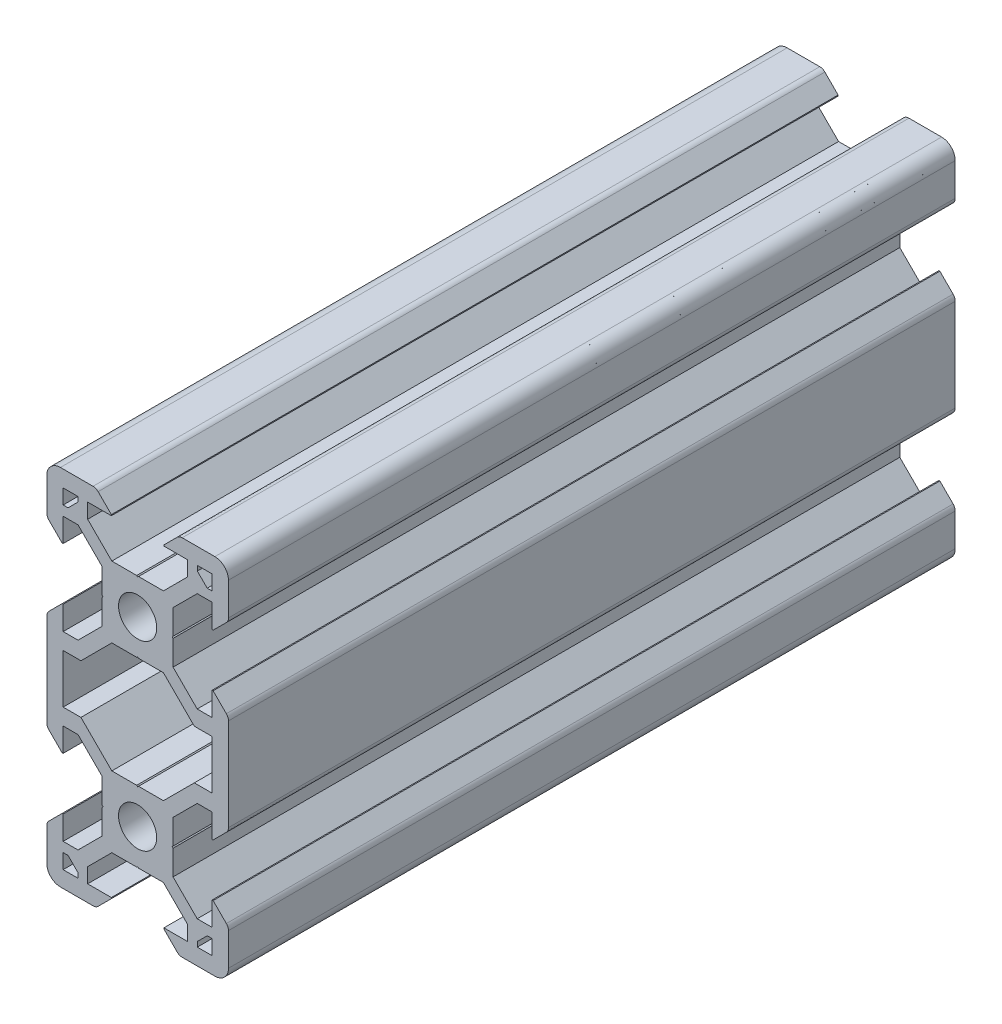
from build123d import *

# Parameters (mm, degrees)
SKETCH2_R           = 2.1
BOSS_EXTRUDE1_DEPTH = 80


with BuildPart() as part:
    # Sketch2 → Boss-Extrude1 (new body)
    with BuildSketch(Plane.XY):
        with BuildLine():
            Line((-0.1, 3.9), (0, 3.8))
            Line((0, 3.8), (0.1, 3.9))
            Line((0.1, 3.9), (2.840365134, 3.9))
            Line((2.840365134, 3.9), (5.5, 6.558825842))
            Line((5.5, 6.558825842), (5.5, 8.197505675))
            Line((5.5, 8.197505675), (2.89, 8.197505675))
            Line((2.89, 8.197505675), (2.89, 8.307505675))
            Line((2.89, 8.307505675), (4.348614357, 9.766120032))
            ThreePointArc((4.348614357, 9.766120032), (4.604908803, 9.937370505), (4.907228714, 9.997505675))
            Line((4.907228714, 9.997505675), (8.5, 9.997505675))
            ThreePointArc((8.5, 9.997505675), (9.560660172, 9.558165846), (10, 8.497505675))
            Line((10, 8.497505675), (10, 4.904734389))
            ThreePointArc((10, 4.904734389), (9.939864831, 4.602414477), (9.768614357, 4.346120032))
            Line((9.768614357, 4.346120032), (8.31, 2.887505675))
            Line((8.31, 2.887505675), (8.2, 2.887505675))
            Line((8.2, 2.887505675), (8.2, 5.497505675))
            Line((8.2, 5.497505675), (6.56, 5.497505675))
            Line((6.56, 5.497505675), (3.9, 2.83831481))
            Line((3.9, 2.83831481), (3.9, 0.1))
            Line((3.9, 0.1), (3.8, 0))
            Line((3.8, 0), (3.9, -0.1))
            Line((3.9, -0.1), (3.9, -2.84))
            Line((3.9, -2.84), (6.56, -5.5))
            Line((6.56, -5.5), (8.2, -5.5))
            Line((8.2, -5.5), (8.2, -2.89))
            Line((8.2, -2.89), (8.31, -2.89))
            Line((8.31, -2.89), (9.765685425, -4.345685425))
            ThreePointArc((9.765685425, -4.345685425), (9.939103626, -4.605224104), (10, -4.91137085))
            Line((10, -4.91137085), (10, -15.08862915))
            ThreePointArc((10, -15.08862915), (9.939103626, -15.394775896), (9.765685425, -15.654314575))
            Line((9.765685425, -15.654314575), (8.31, -17.11))
            Line((8.31, -17.11), (8.2, -17.11))
            Line((8.2, -17.11), (8.2, -14.5))
            Line((8.2, -14.5), (6.56, -14.5))
            Line((6.56, -14.5), (3.9, -17.16))
            Line((3.9, -17.16), (3.9, -19.9))
            Line((3.9, -19.9), (3.8, -20))
            Line((3.8, -20), (3.9, -20.1))
            Line((3.9, -20.1), (3.9, -22.83831481))
            Line((3.9, -22.83831481), (6.56, -25.497505675))
            Line((6.56, -25.497505675), (8.2, -25.497505675))
            Line((8.2, -25.497505675), (8.2, -22.887505675))
            Line((8.2, -22.887505675), (8.31, -22.887505675))
            Line((8.31, -22.887505675), (9.768614357, -24.346120032))
            ThreePointArc((9.768614357, -24.346120032), (9.939864831, -24.602414477), (10, -24.904734389))
            Line((10, -24.904734389), (10, -28.497505675))
            ThreePointArc((10, -28.497505675), (9.560660172, -29.558165846), (8.5, -29.997505675))
            Line((8.5, -29.997505675), (4.907228714, -29.997505675))
            ThreePointArc((4.907228714, -29.997505675), (4.604908803, -29.937370505), (4.348614357, -29.766120032))
            Line((4.348614357, -29.766120032), (2.89, -28.307505675))
            Line((2.89, -28.307505675), (2.89, -28.197505675))
            Line((2.89, -28.197505675), (5.5, -28.197505675))
            Line((5.5, -28.197505675), (5.5, -26.558825842))
            Line((5.5, -26.558825842), (2.840365134, -23.9))
            Line((2.840365134, -23.9), (0.1, -23.9))
            Line((0.1, -23.9), (0, -23.8))
            Line((0, -23.8), (-0.1, -23.9))
            Line((-0.1, -23.9), (-2.840365134, -23.9))
            Line((-2.840365134, -23.9), (-5.5, -26.558825842))
            Line((-5.5, -26.558825842), (-5.5, -28.197505675))
            Line((-5.5, -28.197505675), (-2.89, -28.197505675))
            Line((-2.89, -28.197505675), (-2.89, -28.307505675))
            Line((-2.89, -28.307505675), (-4.348614357, -29.766120032))
            ThreePointArc((-4.348614357, -29.766120032), (-4.604908803, -29.937370505), (-4.907228714, -29.997505675))
            Line((-4.907228714, -29.997505675), (-8.5, -29.997505675))
            ThreePointArc((-8.5, -29.997505675), (-9.560660172, -29.558165846), (-10, -28.497505675))
            Line((-10, -28.497505675), (-10, -24.904734389))
            ThreePointArc((-10, -24.904734389), (-9.939864831, -24.602414477), (-9.768614357, -24.346120032))
            Line((-9.768614357, -24.346120032), (-8.31, -22.887505675))
            Line((-8.31, -22.887505675), (-8.2, -22.887505675))
            Line((-8.2, -22.887505675), (-8.2, -25.497505675))
            Line((-8.2, -25.497505675), (-6.56, -25.497505675))
            Line((-6.56, -25.497505675), (-3.9, -22.83831481))
            Line((-3.9, -22.83831481), (-3.9, -20.1))
            Line((-3.9, -20.1), (-3.8, -20))
            Line((-3.8, -20), (-3.9, -19.9))
            Line((-3.9, -19.9), (-3.9, -17.16))
            Line((-3.9, -17.16), (-6.56, -14.5))
            Line((-6.56, -14.5), (-8.2, -14.5))
            Line((-8.2, -14.5), (-8.2, -17.11))
            Line((-8.2, -17.11), (-8.31, -17.11))
            Line((-8.31, -17.11), (-9.765685425, -15.654314575))
            ThreePointArc((-9.765685425, -15.654314575), (-9.939103626, -15.394775896), (-10, -15.08862915))
            Line((-10, -15.08862915), (-10, -4.91137085))
            ThreePointArc((-10, -4.91137085), (-9.939103626, -4.605224104), (-9.765685425, -4.345685425))
            Line((-9.765685425, -4.345685425), (-8.31, -2.89))
            Line((-8.31, -2.89), (-8.2, -2.89))
            Line((-8.2, -2.89), (-8.2, -5.5))
            Line((-8.2, -5.5), (-6.56, -5.5))
            Line((-6.56, -5.5), (-3.9, -2.84))
            Line((-3.9, -2.84), (-3.9, -0.1))
            Line((-3.9, -0.1), (-3.8, 0))
            Line((-3.8, 0), (-3.9, 0.1))
            Line((-3.9, 0.1), (-3.9, 2.83831481))
            Line((-3.9, 2.83831481), (-6.56, 5.497505675))
            Line((-6.56, 5.497505675), (-8.2, 5.497505675))
            Line((-8.2, 5.497505675), (-8.2, 2.887505675))
            Line((-8.2, 2.887505675), (-8.31, 2.887505675))
            Line((-8.31, 2.887505675), (-9.768614357, 4.346120032))
            ThreePointArc((-9.768614357, 4.346120032), (-9.939864831, 4.602414477), (-10, 4.904734389))
            Line((-10, 4.904734389), (-10, 8.497505675))
            ThreePointArc((-10, 8.497505675), (-9.560660172, 9.558165846), (-8.5, 9.997505675))
            Line((-8.5, 9.997505675), (-4.907228714, 9.997505675))
            ThreePointArc((-4.907228714, 9.997505675), (-4.604908803, 9.937370505), (-4.348614357, 9.766120032))
            Line((-4.348614357, 9.766120032), (-2.89, 8.307505675))
            Line((-2.89, 8.307505675), (-2.89, 8.197505675))
            Line((-2.89, 8.197505675), (-5.5, 8.197505675))
            Line((-5.5, 8.197505675), (-5.5, 6.558825842))
            Line((-5.5, 6.558825842), (-2.840365134, 3.9))
            Line((-2.840365134, 3.9), (-0.1, 3.9))
        make_face()
        Circle(SKETCH2_R, mode=Mode.SUBTRACT)
        with Locations(Location((0, -20, 0), (0, 0, 180))):
            Circle(SKETCH2_R, mode=Mode.SUBTRACT)
        Polygon((-7.66, 6.567505675), (-6.57, 7.657505675), (-6.57, 8.197505675), (-8.2, 8.197505675), (-8.2, 6.567505675), align=None, mode=Mode.SUBTRACT)
        Polygon((-0.1, -3.9), (0, -3.8), (0.1, -3.9), (2.840365134, -3.9), (6.24, -7.299634866), (8.2, -7.299634866), (8.2, -12.700365134), (6.24, -12.700365134), (2.840365134, -16.1), (0.1, -16.1), (0, -16.2), (-0.1, -16.1), (-2.840365134, -16.1), (-6.24, -12.700365134), (-8.2, -12.700365134), (-8.2, -7.299634866), (-6.24, -7.299634866), (-2.840365134, -3.9), align=None, mode=Mode.SUBTRACT)
        Polygon((8.2, 6.567505675), (7.66, 6.567505675), (6.57, 7.657505675), (6.57, 8.197505675), (8.2, 8.197505675), align=None, mode=Mode.SUBTRACT)
        Polygon((7.66, -26.567505675), (6.57, -27.657505675), (6.57, -28.197505675), (8.2, -28.197505675), (8.2, -26.567505675), align=None, mode=Mode.SUBTRACT)
        Polygon((-8.2, -26.567505675), (-7.66, -26.567505675), (-6.57, -27.657505675), (-6.57, -28.197505675), (-8.2, -28.197505675), align=None, mode=Mode.SUBTRACT)
    extrude(amount=-BOSS_EXTRUDE1_DEPTH)


solid = part.part
